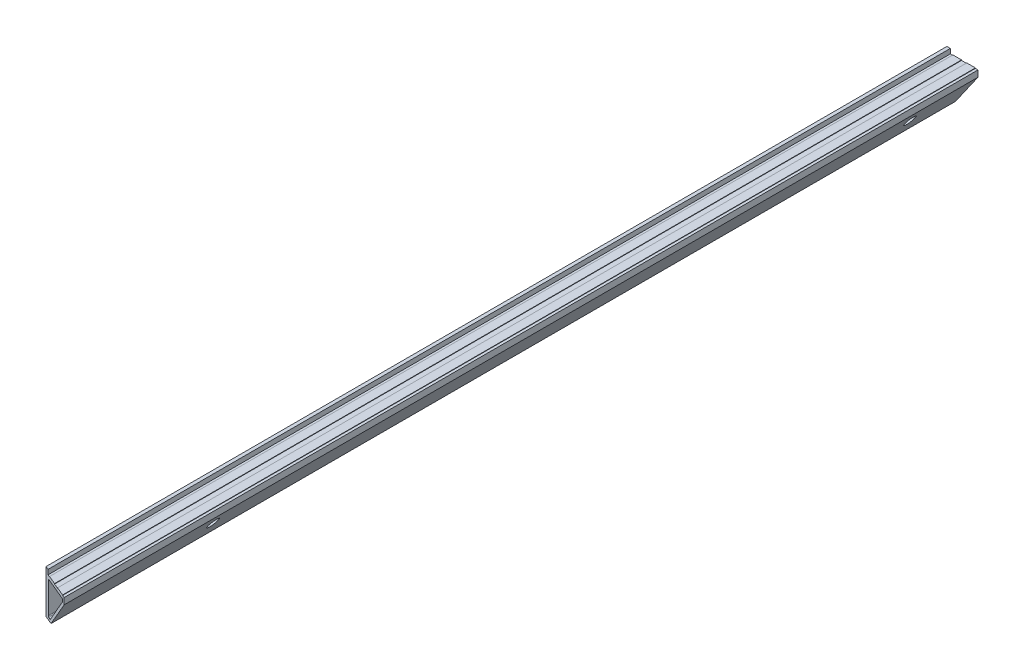
from build123d import *

# Parameters (mm, degrees)
EXTRUDE_1_DEPTH        = 1056
HOLE_WIZARD_7_0_7_1_D  = 7
CUT_EXTRUDE_2_REACH    = 1059.571
SKETCH_5_R             = 6
HOLE_WIZARD_M5_1_D     = 5
HOLE_WIZARD_M5_1_DEPTH = 4.5
HOLE_WIZARD_M5_2_D     = 5
HOLE_WIZARD_M5_2_DEPTH = 4.5
CUT_EXTRUDE_3_DEPTH    = 1058.795821508


with BuildPart() as part:
    # 草图1 → 凸台-拉伸1 (new body)
    with BuildSketch(Plane.XY):
        Polygon((36, -0.5), (36, -7.842615501), (10, -45), (0, -45), (0, 0), (0, 5), (4, 5), (4, -0.5), (7, -0.5), (7, 0), (17, 0), (17, -0.5), (23, -0.5), (23, 0), (33, 0), (33, -0.5), align=None)
        with BuildLine():
            Line((33, -5), (33, -6.582130473))
            ThreePointArc((33, -6.582130473), (32.953765498, -6.882682255), (32.819337252, -7.155442314))
            Line((32.819337252, -7.155442314), (8.736247988, -41.573311842))
            ThreePointArc((8.736247988, -41.573311842), (8.378802584, -41.886936255), (7.916910736, -42))
            Line((7.916910736, -42), (5.5, -42))
            ThreePointArc((5.5, -42), (4.792893219, -41.707106781), (4.5, -41))
            Line((4.5, -41), (4.5, -5))
            ThreePointArc((4.5, -5), (4.792893219, -4.292893219), (5.5, -4))
            Line((5.5, -4), (32, -4))
            ThreePointArc((32, -4), (32.707106781, -4.292893219), (33, -5))
        make_face(mode=Mode.SUBTRACT)
    extrude(amount=EXTRUDE_1_DEPTH)

    # Ø7.0 (7) 直径孔1 (through all)
    with Locations(Plane.ZY):
        with Locations((68.68, -22), (874, -22)):
            Hole(HOLE_WIZARD_7_0_7_1_D / 2)

    # 切除-拉伸2: up to this plane
    cut_extrude_2_end = Plane(origin=(32.819337252, -7.155442314, 1056), z_dir=(-0.8193372517042258, 0.5733118418188885, 0))
    # 草图5 → 切除-拉伸2 (cut, up to the surface)
    with BuildSketch(Plane(origin=(36, 0, 0), x_dir=(0, 0, -1), z_dir=(1, 0, 0)), mode=Mode.PRIVATE) as cut_extrude_2_sk1:
        with Locations(Location((-68.68, -22.072492254, 0), (0, 0, 90))):
            Circle(SKETCH_5_R)
    cut_extrude_2_tool1 = split(extrude(cut_extrude_2_sk1.sketch, amount=-CUT_EXTRUDE_2_REACH, mode=Mode.PRIVATE), bisect_by=cut_extrude_2_end, keep=Keep.BOTH, mode=Mode.PRIVATE)
    add(cut_extrude_2_tool1.solids().sort_by_distance((36, -22.072492, 68.68))[0], mode=Mode.SUBTRACT)
    # 草图5 → 切除-拉伸2 (cut, up to the surface)
    with BuildSketch(Plane(origin=(36, 0, 0), x_dir=(0, 0, -1), z_dir=(1, 0, 0)), mode=Mode.PRIVATE) as cut_extrude_2_sk2:
        with Locations(Location((-874, -22, 0), (0, 0, 90))):
            Circle(SKETCH_5_R)
    cut_extrude_2_tool2 = split(extrude(cut_extrude_2_sk2.sketch, amount=-CUT_EXTRUDE_2_REACH, mode=Mode.PRIVATE), bisect_by=cut_extrude_2_end, keep=Keep.BOTH, mode=Mode.PRIVATE)
    add(cut_extrude_2_tool2.solids().sort_by_distance((36, -22, 874))[0], mode=Mode.SUBTRACT)

    # M5 螺纹孔1
    with Locations(Plane.ZY):
        with Locations((18.636598419, -11.935996902), (18.636598419, -32), (118.675555099, -11.935996902), (118.675555099, -32)):
            Hole(HOLE_WIZARD_M5_1_D / 2, depth=HOLE_WIZARD_M5_1_DEPTH)

    # M5 螺纹孔2
    with Locations(Plane.ZY):
        with Locations((850, -12), (898, -12), (898, -32), (850, -32)):
            Hole(HOLE_WIZARD_M5_2_D / 2, depth=HOLE_WIZARD_M5_2_DEPTH)

    # 草图11 → 切除-拉伸3 (cut, through all)
    with BuildSketch(Plane(origin=(0, 5, 0), x_dir=(1, 0, 0), z_dir=(0, 1, 0))):
        Polygon((36, -1056), (0, -1040.940873789), (0, -1056), align=None)
    extrude(amount=-CUT_EXTRUDE_3_DEPTH, mode=Mode.SUBTRACT)


solid = part.part
